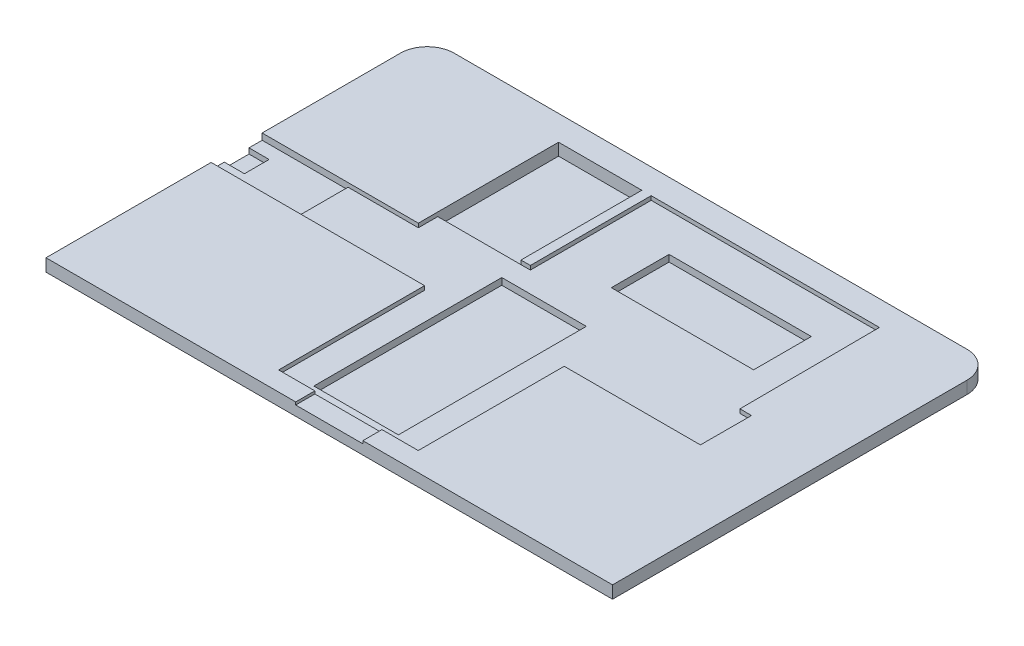
from build123d import *

# Parameters (mm, degrees)
BOSS_EXTRUDE1_DEPTH = 4.65
SKETCH2_W           = 32
SKETCH2_H           = 19
CUT_EXTRUDE1_DEPTH  = 2.35
SKETCH3_W           = 7.5
SKETCH3_H           = 9.2
CUT_EXTRUDE2_DEPTH  = 2
SKETCH4_W           = 31
SKETCH4_H           = 45
CUT_EXTRUDE3_DEPTH  = 4.5
SKETCH5_W           = 53
SKETCH5_H           = 21.5
CUT_EXTRUDE4_DEPTH  = 4
CUT_EXTRUDE5_DEPTH  = 1.5
SKETCH7_W           = 25
SKETCH7_H           = 13.967841501
CUT_EXTRUDE6_DEPTH  = 1
SKETCH9_W           = 31.5
SKETCH9_H           = 70
CUT_EXTRUDE8_DEPTH  = 4


with BuildPart() as part:
    # Sketch1 → Boss-Extrude1 (new body)
    with BuildSketch(Plane(origin=(0, 0, 0), x_dir=(1, 0, 0), z_dir=(0, 1, 0))):
        with BuildLine():
            Line((0, 0), (211, 0))
            Line((211, 0), (211, 132))
            ThreePointArc((211, 132), (208.071067812, 139.071067812), (201, 142))
            Line((201, 142), (10, 142))
            ThreePointArc((10, 142), (2.928932188, 139.071067812), (0, 132))
            Line((0, 132), (0, 0))
        make_face()
    extrude(amount=BOSS_EXTRUDE1_DEPTH)

    # Sketch2 → Cut-Extrude1 (cut)
    with BuildSketch(Plane(origin=(0, 4.65, 0), x_dir=(1, 0, 0), z_dir=(0, 1, 0))):
        with Locations((16, 71)):
            Rectangle(SKETCH2_W, SKETCH2_H)
    extrude(amount=-CUT_EXTRUDE1_DEPTH, mode=Mode.SUBTRACT)

    # Sketch3 → Cut-Extrude2 (cut)
    with BuildSketch(Plane(origin=(0, 2.3, 0), x_dir=(1, 0, 0), z_dir=(0, 1, 0))):
        with Locations((3.75, 71)):
            Rectangle(SKETCH3_W, SKETCH3_H)
    extrude(amount=-CUT_EXTRUDE2_DEPTH, mode=Mode.SUBTRACT)

    # Sketch4 → Cut-Extrude3 (cut)
    with BuildSketch(Plane(origin=(0, 4.65, 0), x_dir=(1, 0, 0), z_dir=(0, 1, 0))):
        with Locations((73.681319495, 110.218338853)):
            Rectangle(SKETCH4_W, SKETCH4_H)
    extrude(amount=-CUT_EXTRUDE3_DEPTH, mode=Mode.SUBTRACT)

    # Sketch5 → Cut-Extrude4 (cut)
    with BuildSketch(Plane(origin=(0, 4.65, 0), x_dir=(1, 0, 0), z_dir=(0, 1, 0))):
        with Locations((139.927272952, 107.871903627)):
            Rectangle(SKETCH5_W, SKETCH5_H)
    extrude(amount=-CUT_EXTRUDE4_DEPTH, mode=Mode.SUBTRACT)

    # Sketch6 → Cut-Extrude5 (cut)
    with BuildSketch(Plane(origin=(0, 4.65, 0), x_dir=(1, 0, 0), z_dir=(0, 1, 0))):
        Polygon((32, 61.5), (79.5, 61.5), (79.5, 7.136151196), (131.5, 7.136151196), (131.5, 61.5), (182.227109874, 61.5), (182.261915258, 80.5), (177.949598934, 80.5), (177.678969488, 132.72), (92.678969488, 132.72), (92.678969488, 87.718338853), (89.181319495, 87.718338853), (89.181319495, 132.718338853), (58.181319495, 132.718338853), (58.181319495, 80.5), (32, 80.5), align=None)
    extrude(amount=-CUT_EXTRUDE5_DEPTH, mode=Mode.SUBTRACT)

    # Sketch7 → Cut-Extrude6 (cut)
    with BuildSketch(Plane(origin=(0, 4.65, 0), x_dir=(1, 0, 0), z_dir=(0, 1, 0))):
        with Locations((105.5, 6.983920751)):
            Rectangle(SKETCH7_W, SKETCH7_H)
    extrude(amount=-CUT_EXTRUDE6_DEPTH, mode=Mode.SUBTRACT)

    # Sketch9 → Cut-Extrude8 (cut)
    with BuildSketch(Plane(origin=(0, 4.65, 0), x_dir=(1, 0, 0), z_dir=(0, 1, 0))):
        with Locations((105.5, 44.997499802)):
            Rectangle(SKETCH9_W, SKETCH9_H)
    extrude(amount=-CUT_EXTRUDE8_DEPTH, mode=Mode.SUBTRACT)


solid = part.part
